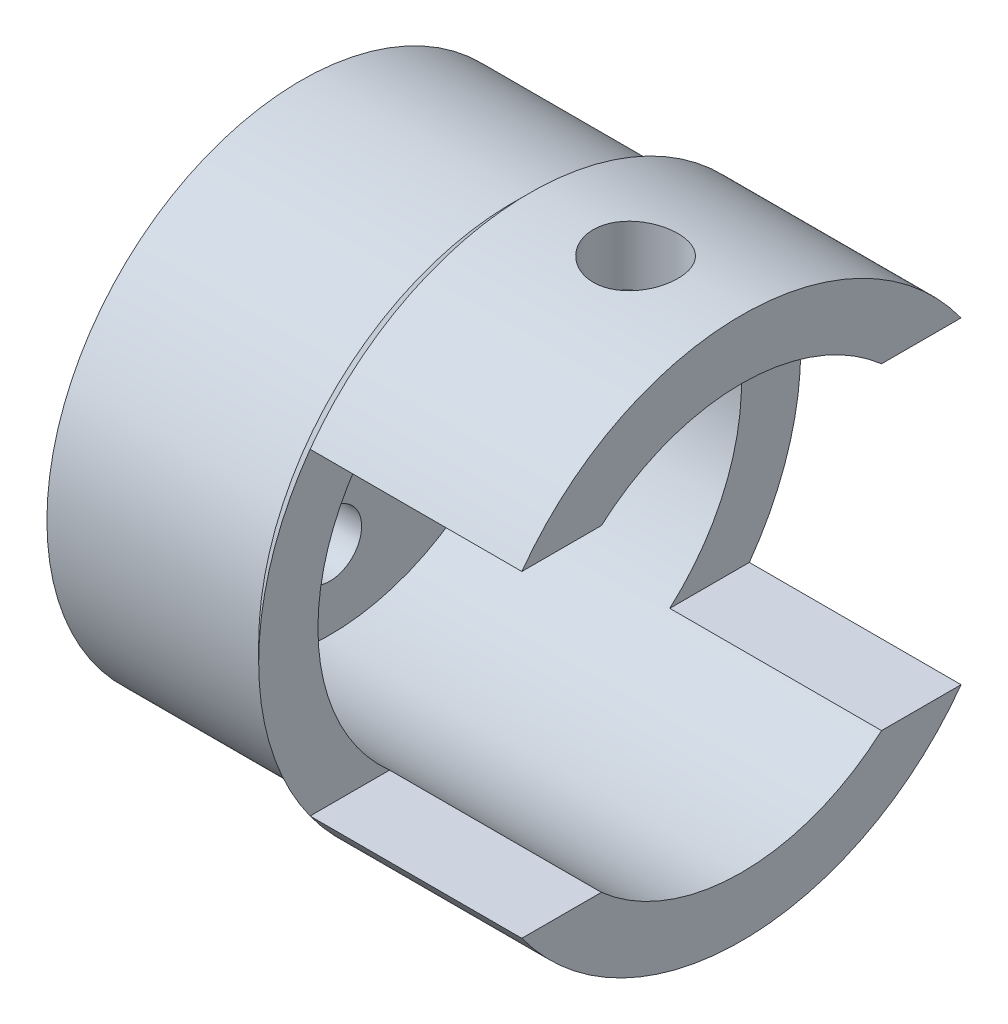
from build123d import *

# Parameters (mm, degrees)
ENL_V_MAT_EXTRU_1_REACH      = 29.571
ESQUISSE2_R                  = 2.5
ESQUISSE2_R_2                = 1.5
ENL_V_MAT_EXTRU_2_DEPTH      = 28.571390703
ENL_V_MAT_EXTRU_2_DEPTH_BACK = 28.571390703
ESQUISSE4_W                  = 15
ESQUISSE4_H                  = 10
ESQUISSE5_R                  = 2
ENL_V_MAT_EXTRU_3_DEPTH      = 10


with BuildPart() as part:
    # Esquisse1 → Révolution1 (revolve)
    with BuildSketch(Plane.XY, mode=Mode.PRIVATE) as r_volution1_sk:
        Polygon((0, 12), (10, 12), (10.798508391, 12.798508391), (20.798508391, 12.798508391), (20.798508391, 10.798508391), (20.798508391, 10), (12.242640687, 10), (1.360795334, 10), (1.360795334, 0), (0, 0), (0, 10), align=None)
    revolve(r_volution1_sk.sketch.rotate(Axis((0, 0, 0), (1, 0, 0)), 90), axis=Axis((0, 0, 0), (1, 0, 0)))

    # Esquisse2 → Enlèv. mat.-Extru.1 (cut, up to next)
    with BuildSketch(Plane.ZY, mode=Mode.PRIVATE) as enl_v_mat_extru_1_sk1:
        Circle(ESQUISSE2_R)
    enl_v_mat_extru_1_tool1 = extrude(enl_v_mat_extru_1_sk1.sketch, amount=-ENL_V_MAT_EXTRU_1_REACH, mode=Mode.PRIVATE) & part.part
    # Esquisse2 → Enlèv. mat.-Extru.1 (cut, up to next)
    with BuildSketch(Plane.ZY, mode=Mode.PRIVATE) as enl_v_mat_extru_1_sk2:
        with Locations((0, 6.3)):
            Circle(ESQUISSE2_R_2)
    enl_v_mat_extru_1_tool2 = extrude(enl_v_mat_extru_1_sk2.sketch, amount=-ENL_V_MAT_EXTRU_1_REACH, mode=Mode.PRIVATE) & part.part
    # Esquisse2 → Enlèv. mat.-Extru.1 (cut, up to next)
    with BuildSketch(Plane.ZY, mode=Mode.PRIVATE) as enl_v_mat_extru_1_sk3:
        with Locations((6.3, 0)):
            Circle(ESQUISSE2_R_2)
    enl_v_mat_extru_1_tool3 = extrude(enl_v_mat_extru_1_sk3.sketch, amount=-ENL_V_MAT_EXTRU_1_REACH, mode=Mode.PRIVATE) & part.part
    # Esquisse2 → Enlèv. mat.-Extru.1 (cut, up to next)
    with BuildSketch(Plane.ZY, mode=Mode.PRIVATE) as enl_v_mat_extru_1_sk4:
        with Locations((0, -6.3)):
            Circle(ESQUISSE2_R_2)
    enl_v_mat_extru_1_tool4 = extrude(enl_v_mat_extru_1_sk4.sketch, amount=-ENL_V_MAT_EXTRU_1_REACH, mode=Mode.PRIVATE) & part.part
    # Esquisse2 → Enlèv. mat.-Extru.1 (cut, up to next)
    with BuildSketch(Plane.ZY, mode=Mode.PRIVATE) as enl_v_mat_extru_1_sk5:
        with Locations((-6.3, 0)):
            Circle(ESQUISSE2_R_2)
    enl_v_mat_extru_1_tool5 = extrude(enl_v_mat_extru_1_sk5.sketch, amount=-ENL_V_MAT_EXTRU_1_REACH, mode=Mode.PRIVATE) & part.part
    add(enl_v_mat_extru_1_tool1.solids().sort_by_distance((0, 0, 0))[0], mode=Mode.SUBTRACT)
    add(enl_v_mat_extru_1_tool2.solids().sort_by_distance((0, 6.3, 0))[0], mode=Mode.SUBTRACT)
    add(enl_v_mat_extru_1_tool3.solids().sort_by_distance((0, 0, 6.3))[0], mode=Mode.SUBTRACT)
    add(enl_v_mat_extru_1_tool4.solids().sort_by_distance((0, -6.3, 0))[0], mode=Mode.SUBTRACT)
    add(enl_v_mat_extru_1_tool5.solids().sort_by_distance((0, 0, -6.3))[0], mode=Mode.SUBTRACT)

    # Esquisse4 → Enlèv. mat.-Extru.2 (cut, two sides: drawn at the far end of the back side and taken through both)
    with BuildSketch(Plane.YX.offset(-ENL_V_MAT_EXTRU_2_DEPTH_BACK)):
        with Locations((0.001491609, 15.798508391)):
            Rectangle(ESQUISSE4_W, ESQUISSE4_H)
    extrude(amount=ENL_V_MAT_EXTRU_2_DEPTH + ENL_V_MAT_EXTRU_2_DEPTH_BACK, mode=Mode.SUBTRACT)

    # Esquisse5 → Enlèv. mat.-Extru.3 (cut)
    with BuildSketch(Plane(origin=(0, 12.798508391, 0), x_dir=(1, 0, 0), z_dir=(0, 1, 0))):
        with Locations(Location((15.798508391, 0, 0), (0, 0, 270))):
            Circle(ESQUISSE5_R)
    extrude(amount=-ENL_V_MAT_EXTRU_3_DEPTH, mode=Mode.SUBTRACT)


solid = part.part
